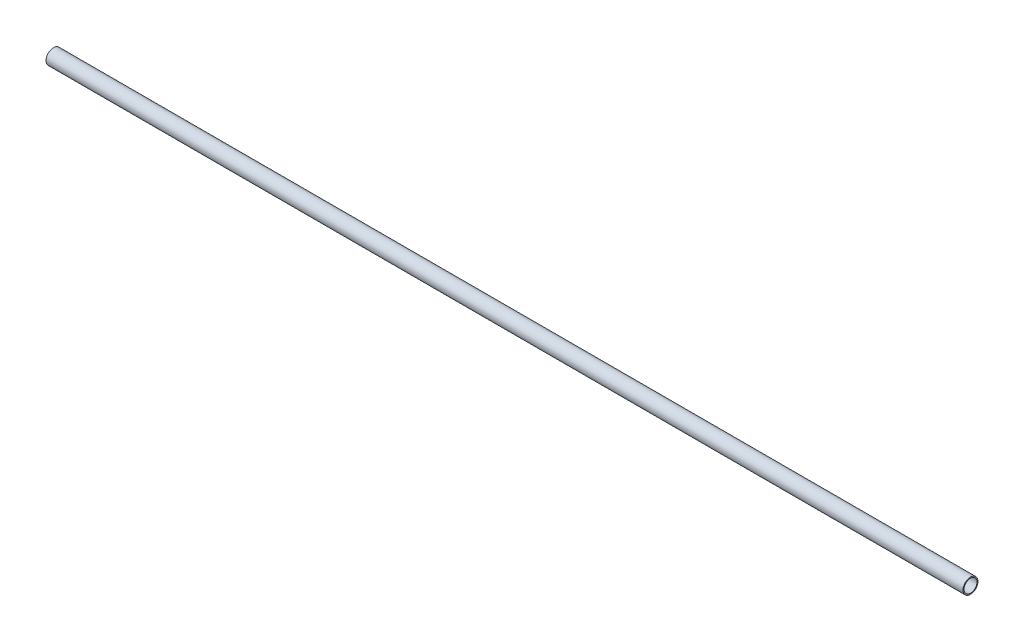
from build123d import *

# Parameters (mm, degrees)
SKETCH1_R           = 0.7366
SKETCH1_R_2         = 0.635
BOSS_EXTRUDE1_DEPTH = 90


with BuildPart() as part:
    # Sketch1 → Boss-Extrude1 (new body)
    with BuildSketch(Plane(origin=(0, 0, 0), x_dir=(0, 0, -1), z_dir=(1, 0, 0))):
        Circle(SKETCH1_R)
        Circle(SKETCH1_R_2, mode=Mode.SUBTRACT)
    extrude(amount=BOSS_EXTRUDE1_DEPTH)


solid = part.part
